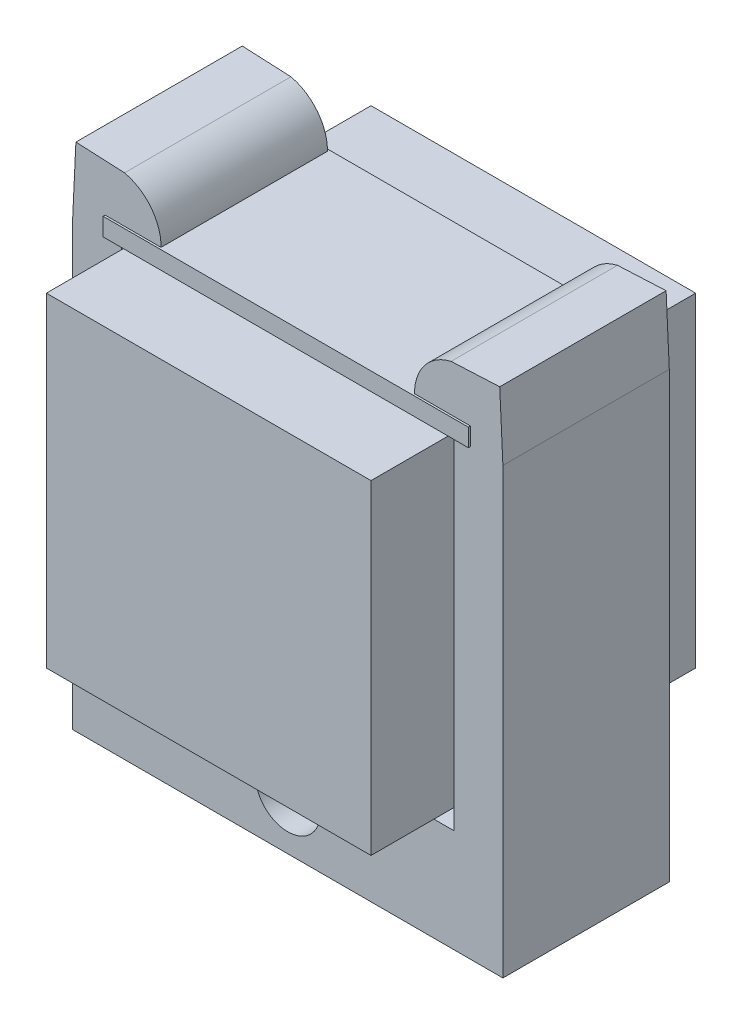
from build123d import *

# Parameters (mm, degrees)
SKETCH1_W                            = 45
SKETCH1_H                            = 21
BOSS_EXTRUDE1_DEPTH                  = 2.2
SKETCH2_W                            = 40
SKETCH2_H                            = 40
BOSS_EXTRUDE2_DEPTH                  = 40
SKETCH3_W                            = 41
SKETCH3_H                            = 12.7
SKETCH3_R                            = 4
SNAPFIT_41MM_SPACING_6MM_WIDTH_DEPTH = 10.25


with BuildPart() as part:
    # Sketch1 → Boss-Extrude1 (new body)
    with BuildSketch(Plane(origin=(0, 0, 0), x_dir=(1, 0, 0), z_dir=(0, 1, 0))):
        Rectangle(SKETCH1_W, SKETCH1_H)
    extrude(amount=BOSS_EXTRUDE1_DEPTH)


with BuildPart() as body_2:
    # Sketch2 → Boss-Extrude2 (new body)
    with BuildSketch(Plane(origin=(0, 0, 0), x_dir=(1, 0, 0), z_dir=(0, 1, 0))):
        Rectangle(SKETCH2_W, SKETCH2_H)
    extrude(amount=-BOSS_EXTRUDE2_DEPTH)


with BuildPart() as body_3:
    # Sketch3 → SnapFit-41mm_spacing-6mm_width (new, symmetric)
    # profile 1 of 3: a face of its own
    with BuildSketch(Plane.XY):
        with Locations((0, -48.35)):
            Rectangle(SKETCH3_W, SKETCH3_H)
        with Locations((0, -48.35)):
            Circle(SKETCH3_R, mode=Mode.SUBTRACT)
    # profile 2 of 3: a face of its own
    with BuildSketch(Plane.XY):
        with BuildLine():
            Line((-26.5, -54.7), (-20.5, -54.7))
            Line((-20.5, -54.7), (-20.5, -42))
            Line((-20.5, -42), (-20.5, 0))
            Line((-20.5, 0), (-20.395356671, 2.197509903))
            Line((-20.395356671, 2.197509903), (-15.616756948, 1.969957535))
            ThreePointArc((-15.616756948, 1.969957535), (-16.789700947, 5.754230658), (-20.116756948, 7.905327833))
            Line((-20.116756948, 7.905327833), (-26.109965775, 8.190718729))
            Line((-26.109965775, 8.190718729), (-26.5, 0))
            Line((-26.5, 0), (-26.5, -54.7))
        make_face()
    # profile 3 of 3: a face of its own
    with BuildSketch(Plane.XY):
        with BuildLine():
            Line((20.5, -42), (20.5, -54.7))
            Line((20.5, -54.7), (26.5, -54.7))
            Line((26.5, -54.7), (26.5, 0))
            Line((26.5, 0), (26.109965775, 8.190718729))
            Line((26.109965775, 8.190718729), (20.116756948, 7.905327833))
            ThreePointArc((20.116756948, 7.905327833), (16.789700947, 5.754230658), (15.616756948, 1.969957535))
            Line((15.616756948, 1.969957535), (20.395356671, 2.197509903))
            Line((20.395356671, 2.197509903), (20.5, 0))
            Line((20.5, 0), (20.5, -42))
        make_face()
    extrude(amount=SNAPFIT_41MM_SPACING_6MM_WIDTH_DEPTH, both=True)


solid = Compound([part.part, body_2.part, body_3.part])
